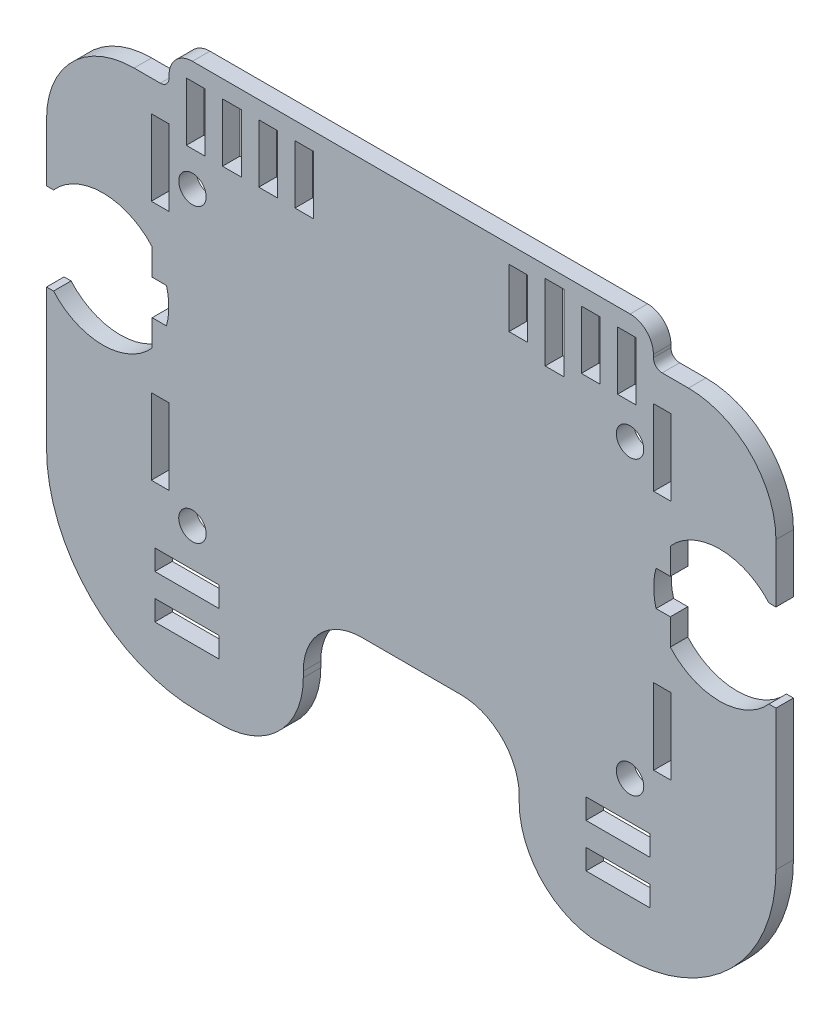
from build123d import *

# Parameters (mm, degrees)
SKICA2_R                = 2.35
SKICA2_W                = 11
SKICA2_H                = 3.499027085
SKICA2_W_2              = 3
SKICA2_H_2              = 13
SKICA2_W_3              = 3.2
SKICA2_H_3              = 10
SKICA2_W_4              = 3.215746781
P_IDAT_VYSUNUT_M1_DEPTH = 3


with BuildPart() as part:
    # Skica2 → Přidat vysunutím1 (new body)
    with BuildSketch(Plane.XY):
        with BuildLine():
            Line((-62.5, 7.5), (-61.3, 7.5))
            ThreePointArc((-61.3, 7.5), (-52.847781356, 11.3), (-44.395562713, 7.5))
            Line((-44.395562713, 7.5), (-44.395562713, 3))
            Line((-44.395562713, 3), (-41.953287334, 3))
            ThreePointArc((-41.953287334, 3), (-41.547781356, 0), (-41.953287334, -3))
            Line((-41.953287334, -3), (-44.395562713, -3))
            Line((-44.395562713, -3), (-44.395562713, -7.5))
            ThreePointArc((-44.395562713, -7.5), (-52.847781356, -11.3), (-61.3, -7.5))
            Line((-61.3, -7.5), (-62.5, -7.5))
            Line((-62.5, -7.5), (-62.5, -16.780342451))
            Line((-62.5, -16.780342451), (-62.5, -31.5))
            ThreePointArc((-62.5, -31.5), (-54.884776311, -49.884776311), (-36.5, -57.5))
            Line((-36.5, -57.5), (-32.5, -57.5))
            ThreePointArc((-32.5, -57.5), (-22.600505063, -53.399494937), (-18.5, -43.5))
            Line((-18.5, -43.5), (-18.5, -42.5))
            ThreePointArc((-18.5, -42.5), (-15.571067812, -35.428932188), (-8.5, -32.5))
            Line((-8.5, -32.5), (8.5, -32.5))
            ThreePointArc((8.5, -32.5), (15.571067812, -35.428932188), (18.5, -42.5))
            Line((18.5, -42.5), (18.5, -43.5))
            ThreePointArc((18.5, -43.5), (22.600505063, -53.399494937), (32.5, -57.5))
            Line((32.5, -57.5), (36.5, -57.5))
            ThreePointArc((36.5, -57.5), (54.884776311, -49.884776311), (62.5, -31.5))
            Line((62.5, -31.5), (62.5, -18.974988021))
            Line((62.5, -18.974988021), (62.5, -7.5))
            Line((62.5, -7.5), (61.3, -7.5))
            ThreePointArc((61.3, -7.5), (52.847781356, -11.3), (44.395562713, -7.5))
            Line((44.395562713, -7.5), (44.395562713, -3))
            Line((44.395562713, -3), (41.953287334, -3))
            ThreePointArc((41.953287334, -3), (41.547781356, 0), (41.953287334, 3))
            Line((41.953287334, 3), (44.395562713, 3))
            Line((44.395562713, 3), (44.395562713, 7.5))
            ThreePointArc((44.395562713, 7.5), (52.847781356, 11.3), (61.3, 7.5))
            Line((61.3, 7.5), (62.5, 7.5))
            Line((62.5, 7.5), (62.5, 17.5))
            ThreePointArc((62.5, 17.5), (58.106601718, 28.106601718), (47.5, 32.5))
            Line((47.5, 32.5), (43, 32.5))
            ThreePointArc((43, 32.5), (41.939339828, 32.939339828), (41.5, 34))
            Line((41.5, 34), (41.5, 34.5))
            ThreePointArc((41.5, 34.5), (40.328427125, 37.328427125), (37.5, 38.5))
            Line((37.5, 38.5), (-37.5, 38.5))
            ThreePointArc((-37.5, 38.5), (-40.328427125, 37.328427125), (-41.5, 34.5))
            Line((-41.5, 34.5), (-41.5, 34))
            ThreePointArc((-41.5, 34), (-41.939339828, 32.939339828), (-43, 32.5))
            Line((-43, 32.5), (-47.5, 32.5))
            ThreePointArc((-47.5, 32.5), (-58.106601718, 28.106601718), (-62.5, 17.5))
            Line((-62.5, 17.5), (-62.5, 7.5))
        make_face()
        with Locations((-37.497781356, 19.55)):
            Circle(SKICA2_R, mode=Mode.SUBTRACT)
        with Locations((-37.5, -30.45)):
            Circle(SKICA2_R, mode=Mode.SUBTRACT)
        with Locations((37.497781356, -30.45)):
            Circle(SKICA2_R, mode=Mode.SUBTRACT)
        with Locations((37.497781356, 19.55)):
            Circle(SKICA2_R, mode=Mode.SUBTRACT)
        with Locations((-38.447781356, -46.193013209)):
            Rectangle(SKICA2_W, SKICA2_H, mode=Mode.SUBTRACT)
        with Locations((-38.447781356, -38.693986123)):
            Rectangle(SKICA2_W, SKICA2_H, mode=Mode.SUBTRACT)
        with Locations((-43.047781356, -20.7)):
            Rectangle(SKICA2_W_2, SKICA2_H_2, mode=Mode.SUBTRACT)
        with Locations((-43.047781356, 20.7)):
            Rectangle(SKICA2_W_2, SKICA2_H_2, mode=Mode.SUBTRACT)
        with Locations((43.047781356, -20.7)):
            Rectangle(SKICA2_W_2, SKICA2_H_2, mode=Mode.SUBTRACT)
        with Locations((43.047781356, 20.7)):
            Rectangle(SKICA2_W_2, SKICA2_H_2, mode=Mode.SUBTRACT)
        with Locations((-36.947781356, 30.5)):
            Rectangle(SKICA2_W_3, SKICA2_H_3, mode=Mode.SUBTRACT)
        with Locations((36.947781356, 30.5)):
            Rectangle(SKICA2_W_3, SKICA2_H_3, mode=Mode.SUBTRACT)
        with Locations((30.747781356, 30.5)):
            Rectangle(SKICA2_W_3, SKICA2_H_3, mode=Mode.SUBTRACT)
        with Locations((24.547781356, 30)):
            Rectangle(SKICA2_W_3, SKICA2_H_2, mode=Mode.SUBTRACT)
        with Locations((35.447781356, -38.693986123)):
            Rectangle(SKICA2_W, SKICA2_H, mode=Mode.SUBTRACT)
        with Locations((-30.739907966, 30.5)):
            Rectangle(SKICA2_W_4, SKICA2_H_3, mode=Mode.SUBTRACT)
        with Locations((-24.532034575, 30.5)):
            Rectangle(SKICA2_W_3, SKICA2_H_3, mode=Mode.SUBTRACT)
        with Locations((-18.332034575, 30.5)):
            Rectangle(SKICA2_W_3, SKICA2_H_3, mode=Mode.SUBTRACT)
        with Locations((18.347781356, 30.5)):
            Rectangle(SKICA2_W_3, SKICA2_H_3, mode=Mode.SUBTRACT)
        with Locations((35.447781356, -46.193013209)):
            Rectangle(SKICA2_W, SKICA2_H, mode=Mode.SUBTRACT)
    extrude(amount=P_IDAT_VYSUNUT_M1_DEPTH)


solid = part.part
